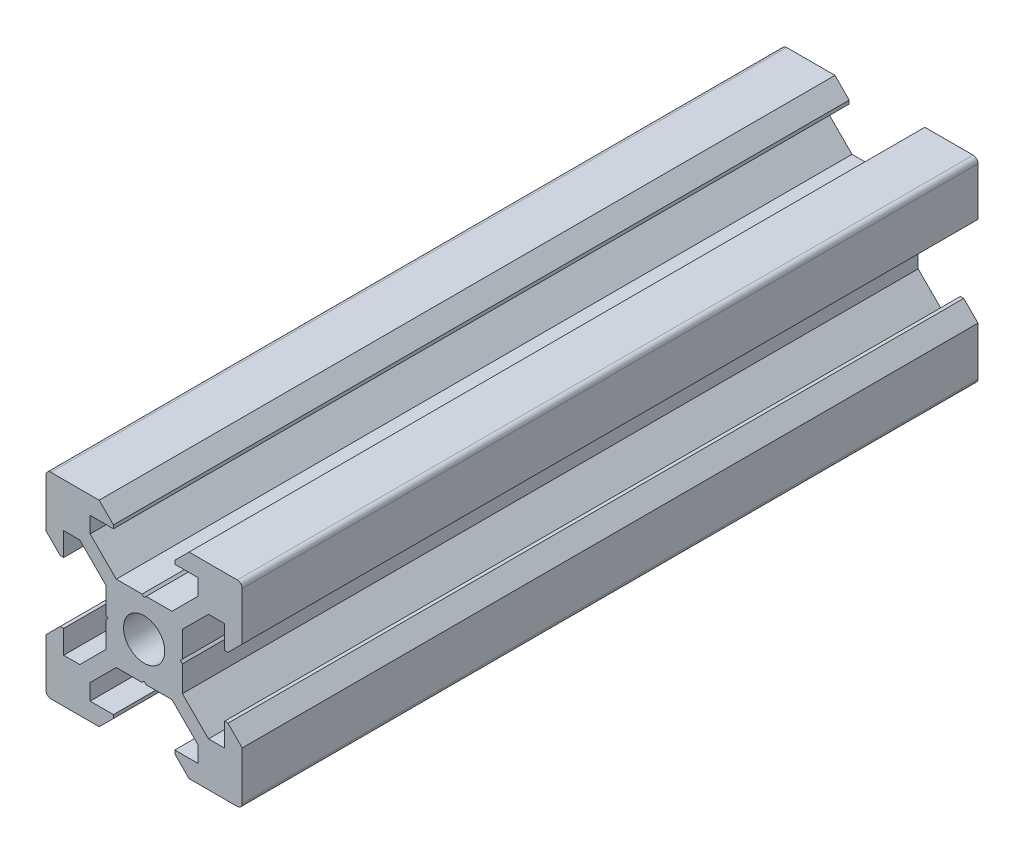
from build123d import *

# Parameters (mm, degrees)
SKETCH1_R           = 2.1
BOSS_EXTRUDE1_DEPTH = 75


with BuildPart() as part:
    # Sketch1 → Boss-Extrude1 (new body)
    with BuildSketch(Plane.XY):
        with BuildLine():
            Line((4.58, -10), (9.5, -10))
            ThreePointArc((9.5, -10), (9.853553391, -9.853553391), (10, -9.5))
            Line((10, -9.5), (10, -4.58))
            Line((10, -4.58), (8.545, -3.125))
            Line((8.545, -3.125), (8.2, -3.125))
            Line((8.2, -3.125), (8.2, -5.5))
            Line((8.2, -5.5), (6.560660172, -5.5))
            Line((6.560660172, -5.5), (3.9, -2.839339828))
            Line((3.9, -2.839339828), (3.9, -0.21))
            Line((3.9, -0.21), (3.69, 0))
            Line((3.69, 0), (3.9, 0.21))
            Line((3.9, 0.21), (3.9, 2.839339828))
            Line((3.9, 2.839339828), (6.560660172, 5.5))
            Line((6.560660172, 5.5), (8.2, 5.5))
            Line((8.2, 5.5), (8.2, 3.125))
            Line((8.2, 3.125), (8.545, 3.125))
            Line((8.545, 3.125), (10, 4.58))
            Line((10, 4.58), (10, 9.5))
            ThreePointArc((10, 9.5), (9.853553391, 9.853553391), (9.5, 10))
            Line((9.5, 10), (4.58, 10))
            Line((4.58, 10), (3.125, 8.545))
            Line((3.125, 8.545), (3.125, 8.2))
            Line((3.125, 8.2), (5.5, 8.2))
            Line((5.5, 8.2), (5.5, 6.560660172))
            Line((5.5, 6.560660172), (2.839339828, 3.9))
            Line((2.839339828, 3.9), (0.21, 3.9))
            Line((0.21, 3.9), (0, 3.69))
            Line((0, 3.69), (-0.21, 3.9))
            Line((-0.21, 3.9), (-2.839339828, 3.9))
            Line((-2.839339828, 3.9), (-5.5, 6.560660172))
            Line((-5.5, 6.560660172), (-5.5, 8.2))
            Line((-5.5, 8.2), (-3.125, 8.2))
            Line((-3.125, 8.2), (-3.125, 8.545))
            Line((-3.125, 8.545), (-4.58, 10))
            Line((-4.58, 10), (-9.5, 10))
            ThreePointArc((-9.5, 10), (-9.853553391, 9.853553391), (-10, 9.5))
            Line((-10, 9.5), (-10, 4.58))
            Line((-10, 4.58), (-8.545, 3.125))
            Line((-8.545, 3.125), (-8.2, 3.125))
            Line((-8.2, 3.125), (-8.2, 5.5))
            Line((-8.2, 5.5), (-6.560660172, 5.5))
            Line((-6.560660172, 5.5), (-3.9, 2.839339828))
            Line((-3.9, 2.839339828), (-3.9, 0.21))
            Line((-3.9, 0.21), (-3.69, 0))
            Line((-3.69, 0), (-3.9, -0.21))
            Line((-3.9, -0.21), (-3.9, -2.839339828))
            Line((-3.9, -2.839339828), (-6.560660172, -5.5))
            Line((-6.560660172, -5.5), (-8.2, -5.5))
            Line((-8.2, -5.5), (-8.2, -3.125))
            Line((-8.2, -3.125), (-8.545, -3.125))
            Line((-8.545, -3.125), (-10, -4.58))
            Line((-10, -4.58), (-10, -9.5))
            ThreePointArc((-10, -9.5), (-9.853553391, -9.853553391), (-9.5, -10))
            Line((-9.5, -10), (-4.58, -10))
            Line((-4.58, -10), (-3.125, -8.545))
            Line((-3.125, -8.545), (-3.125, -8.2))
            Line((-3.125, -8.2), (-5.5, -8.2))
            Line((-5.5, -8.2), (-5.5, -6.560660172))
            Line((-5.5, -6.560660172), (-2.839339828, -3.9))
            Line((-2.839339828, -3.9), (-0.21, -3.9))
            Line((-0.21, -3.9), (0, -3.69))
            Line((0, -3.69), (0.21, -3.9))
            Line((0.21, -3.9), (2.839339828, -3.9))
            Line((2.839339828, -3.9), (5.5, -6.560660172))
            Line((5.5, -6.560660172), (5.5, -8.2))
            Line((5.5, -8.2), (3.125, -8.2))
            Line((3.125, -8.2), (3.125, -8.545))
            Line((3.125, -8.545), (4.58, -10))
        make_face()
        Circle(SKETCH1_R, mode=Mode.SUBTRACT)
    extrude(amount=BOSS_EXTRUDE1_DEPTH)


solid = part.part
